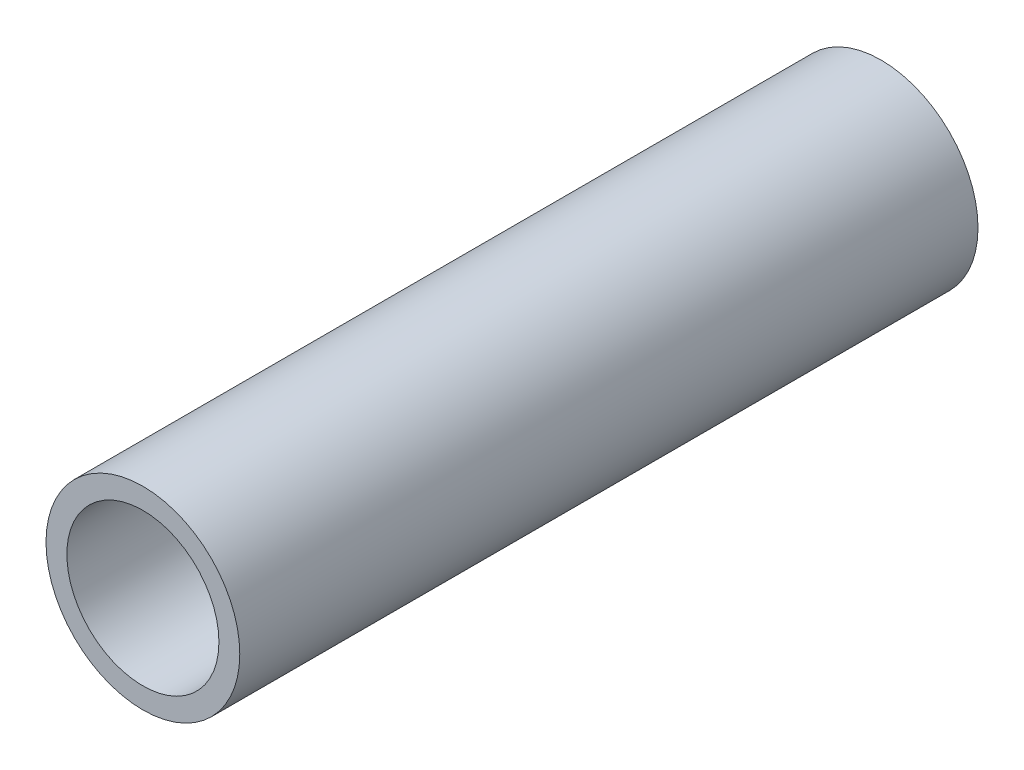
from build123d import *

# Parameters (mm, degrees)
SKETCH1_R           = 13.335
SKETCH1_R_2         = 10.4648
BOSS_EXTRUDE1_DEPTH = 101.6


with BuildPart() as part:
    # Sketch1 → Boss-Extrude1 (new body)
    with BuildSketch(Plane.XY):
        Circle(SKETCH1_R)
        Circle(SKETCH1_R_2, mode=Mode.SUBTRACT)
    extrude(amount=BOSS_EXTRUDE1_DEPTH)


solid = part.part
